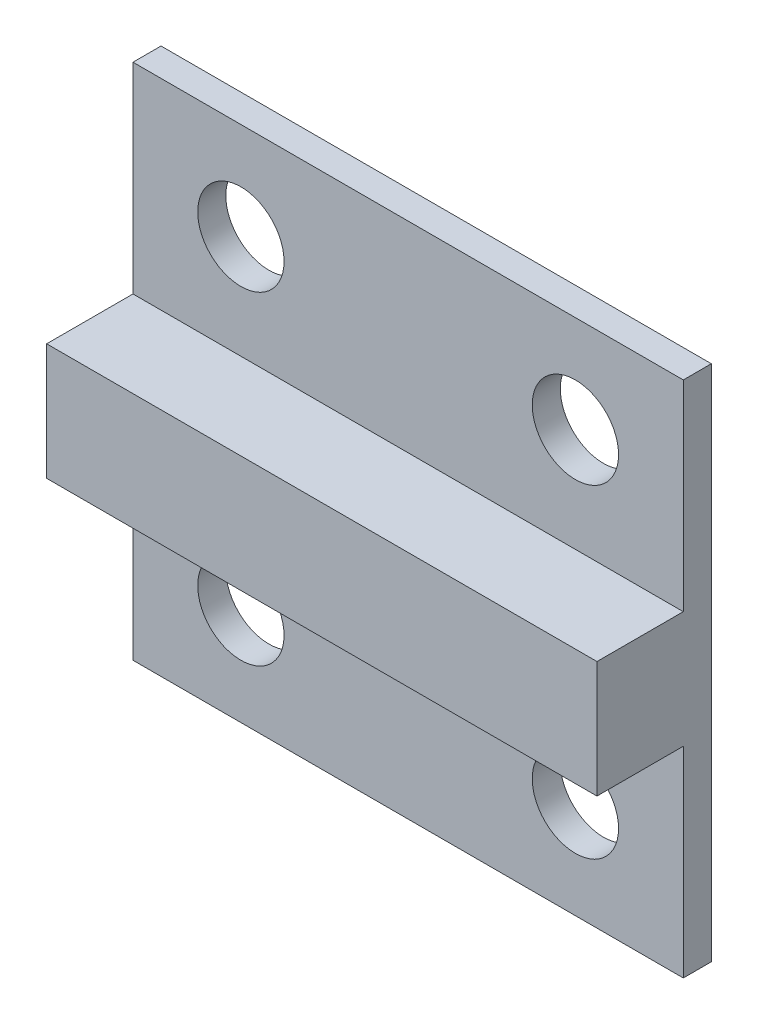
from build123d import *

# Parameters (mm, degrees)
SKETCH1_W           = 25.5
SKETCH1_H           = 24
BOSS_EXTRUDE1_DEPTH = 1.3
SKETCH2_W           = 25.5
SKETCH2_H           = 5.4
BOSS_EXTRUDE2_DEPTH = 4
SKETCH3_R           = 2
CUT_EXTRUDE1_DEPTH  = 4
SKETCH4_R           = 2
CUT_EXTRUDE2_DEPTH  = 4


with BuildPart() as part:
    # Sketch1 → Boss-Extrude1 (new body)
    with BuildSketch(Plane.XY):
        with Locations((14.577148508, 8.992218626)):
            Rectangle(SKETCH1_W, SKETCH1_H)
    extrude(amount=BOSS_EXTRUDE1_DEPTH)

    # Sketch2 → Boss-Extrude2 (add)
    with BuildSketch(Plane.XY.offset(1.3)):
        with Locations((14.577148508, 8.992218626)):
            Rectangle(SKETCH2_W, SKETCH2_H)
    extrude(amount=BOSS_EXTRUDE2_DEPTH)

    # Sketch3 → Cut-Extrude1 (cut)
    with BuildSketch(Plane.XY.offset(1.3)):
        with Locations((22.327148508, 16.492218626)):
            Circle(SKETCH3_R)
        with Locations((6.827148508, 16.492218626)):
            Circle(SKETCH3_R)
    extrude(amount=-CUT_EXTRUDE1_DEPTH, mode=Mode.SUBTRACT)

    # Sketch4 → Cut-Extrude2 (cut)
    with BuildSketch(Plane.XY.offset(1.3)):
        with Locations((6.827148508, 1.492218626)):
            Circle(SKETCH4_R)
        with Locations((22.327148508, 1.492218626)):
            Circle(SKETCH4_R)
    extrude(amount=-CUT_EXTRUDE2_DEPTH, mode=Mode.SUBTRACT)


solid = part.part
